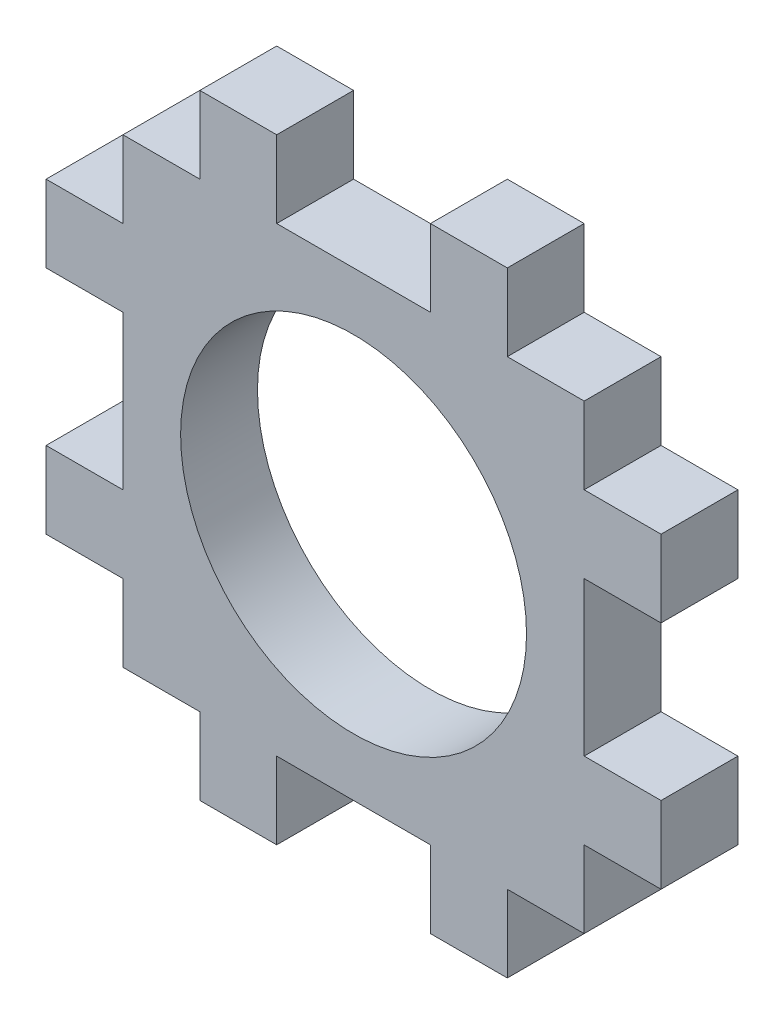
from build123d import *

# Parameters (mm, degrees)
SKETCH1_R           = 11.25
BOSS_EXTRUDE1_DEPTH = 5


with BuildPart() as part:
    # Sketch1 → Boss-Extrude1 (new body)
    with BuildSketch(Plane.XY):
        Polygon((5, 15), (-5, 15), (-5, 20), (-10, 20), (-10, 15), (-15, 15), (-15, 10), (-20, 10), (-20, 5), (-15, 5), (-15, -5), (-20, -5), (-20, -10), (-15, -10), (-15, -15), (-10, -15), (-10, -20), (-5, -20), (-5, -15), (5, -15), (5, -20), (10, -20), (10, -15), (15, -15), (15, -10), (20, -10), (20, -5), (15, -5), (15, 5), (20, 5), (20, 10), (15, 10), (15, 15), (10, 15), (10, 20), (5, 20), align=None)
        Circle(SKETCH1_R, mode=Mode.SUBTRACT)
    extrude(amount=BOSS_EXTRUDE1_DEPTH)


solid = part.part
